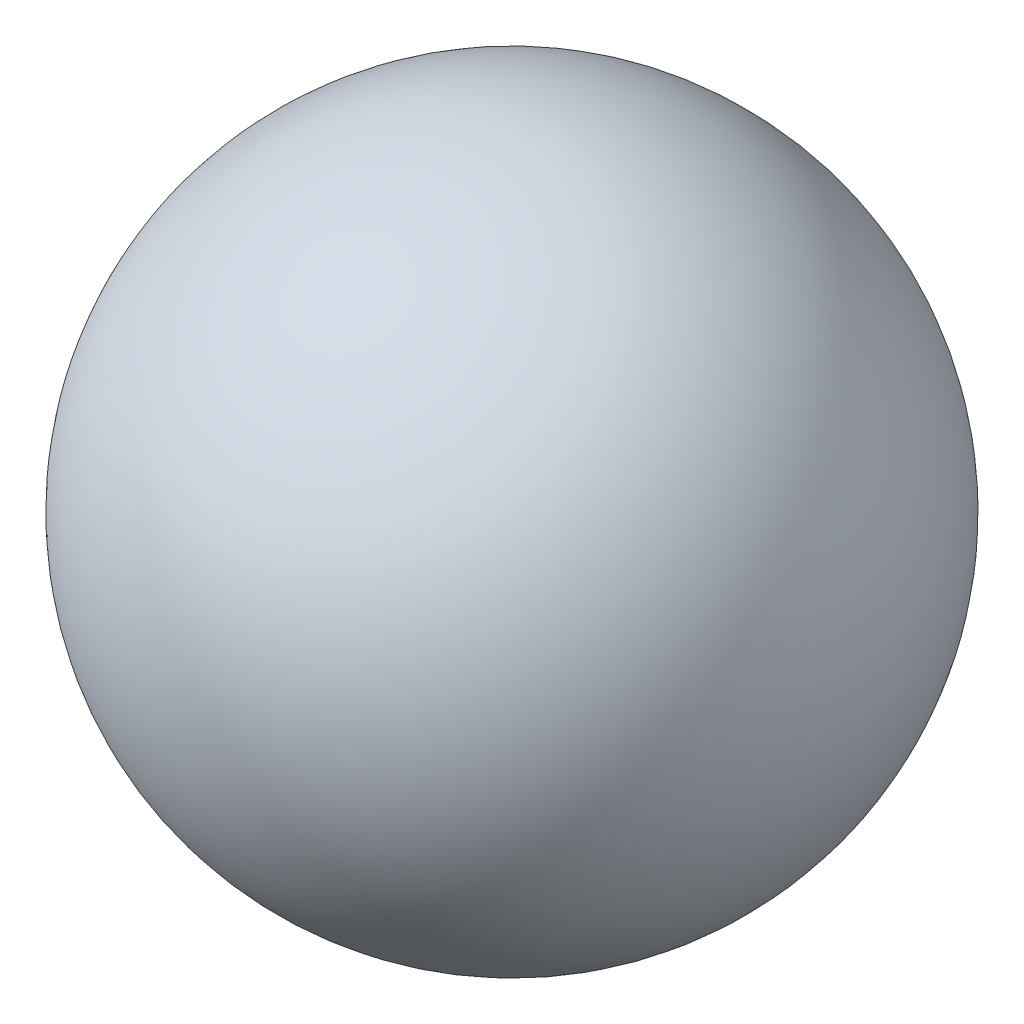
from build123d import *


with BuildPart() as part:
    # Sketch1 → Revolve7 (revolve)
    with BuildSketch(Plane.XY):
        with BuildLine():
            Line((19.939, 0), (-19.939, 0))
            ThreePointArc((-19.939, 0), (0, 19.939), (19.939, 0))
        make_face()
    revolve(axis=Axis((-19.939, 0, 0), (1, 0, 0)))


solid = part.part
